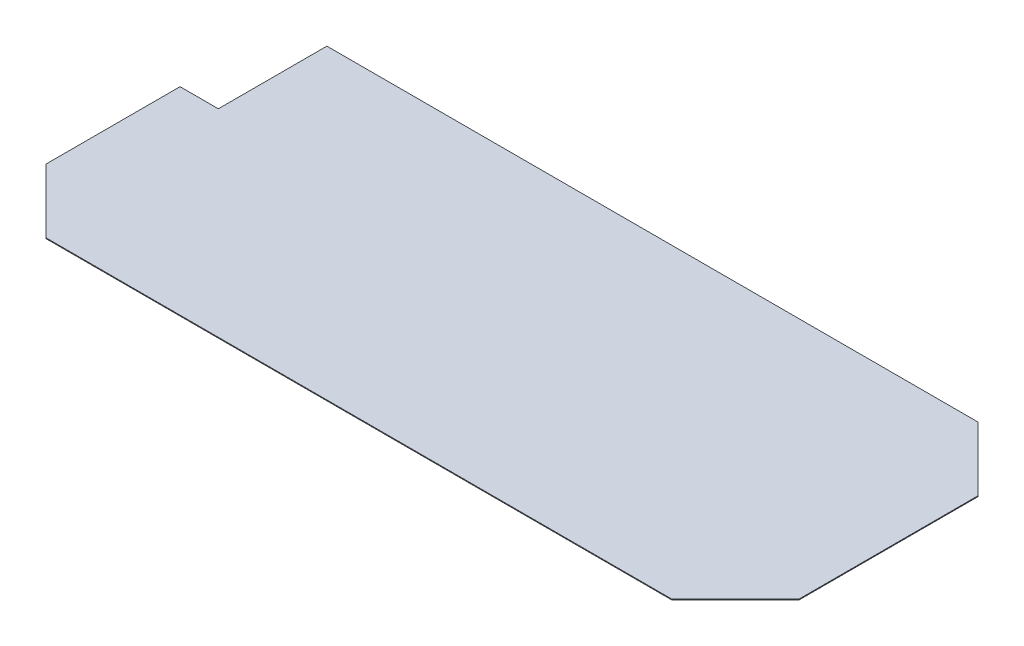
from build123d import *

# Parameters (mm, degrees)
BOSS_EXTRUDE1_DEPTH = 1.5875


with BuildPart() as part:
    # Sketch1 → Boss-Extrude1 (new body)
    with BuildSketch(Plane(origin=(0, 0, 0), x_dir=(1, 0, 0), z_dir=(0, 1, 0))):
        Polygon((1498.6, 127), (1371.6, 0), (127, 0), (0, 127), (0, 393.7), (76.2, 393.7), (76.2, 609.6), (1371.6, 609.6), (1498.6, 482.6), align=None)
    extrude(amount=BOSS_EXTRUDE1_DEPTH)


solid = part.part
